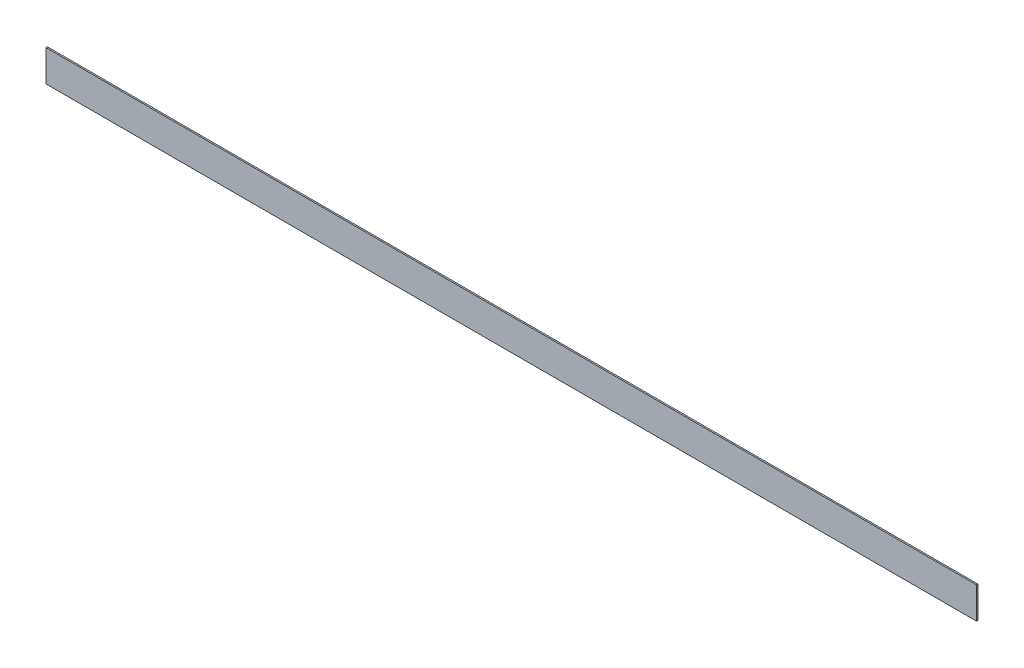
from build123d import *

# Parameters (mm, degrees)
SKETCH1_W           = 1331
SKETCH1_H           = 45
BOSS_EXTRUDE1_DEPTH = 2


with BuildPart() as part:
    # Sketch1 → Boss-Extrude1 (new body)
    with BuildSketch(Plane.XY):
        Rectangle(SKETCH1_W, SKETCH1_H)
    extrude(amount=BOSS_EXTRUDE1_DEPTH)


solid = part.part
